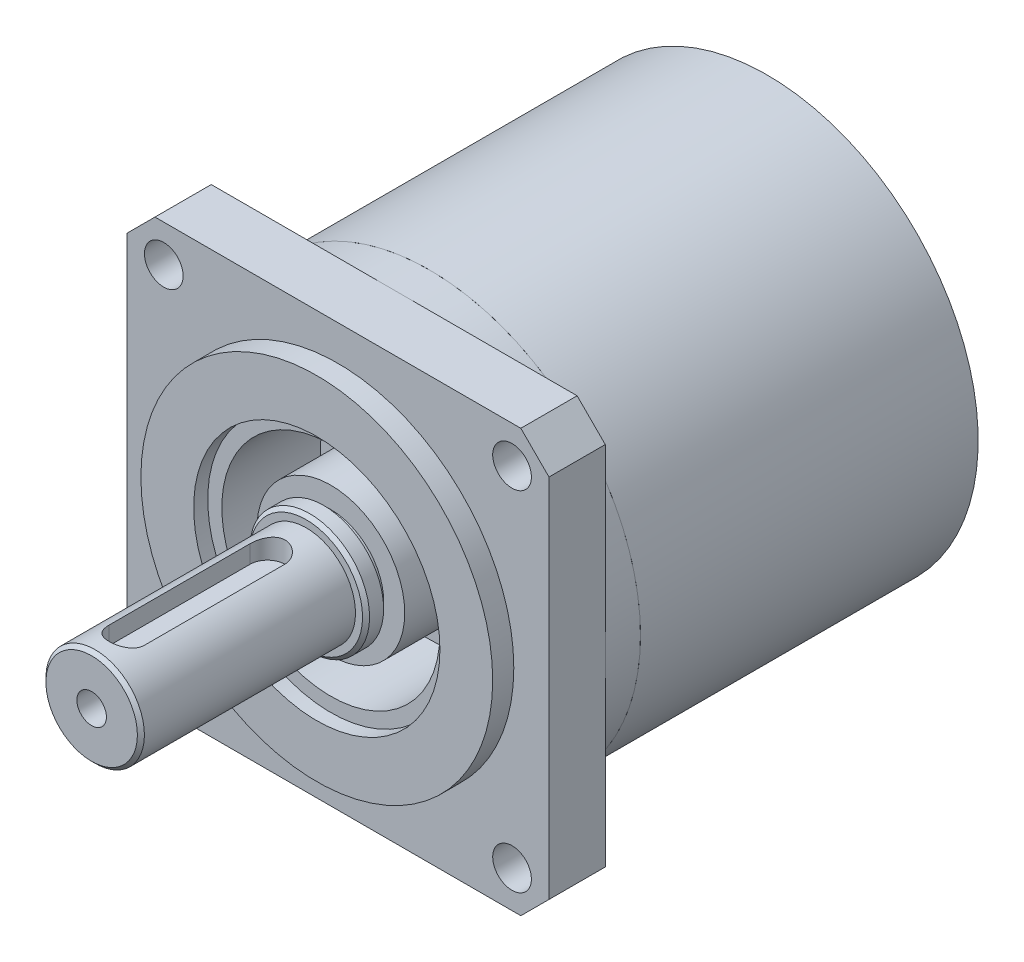
from build123d import *

# Parameters (mm, degrees)
SKETCH_1_R               = 30
EXTRUDE_1_DEPTH          = 13
SKETCH_2_R               = 30
EXTRUDE_2_DEPTH          = 48
SKETCH_3_R               = 25
SKETCH_3_R_2             = 17.5
EXTRUDE_3_DEPTH          = 3
CUT_EXTRUDE_START        = -13
SKETCH_4_R               = 17.5
CUT_EXTRUDE_1_DEPTH      = 13
SKETCH_6_R               = 17.5
SKETCH_6_R_2             = 15.5
EXTRUDE_4_DEPTH          = 14
SKETCH_7_R               = 10.5
EXTRUDE_5_DEPTH          = 14
SKETCH_8_R               = 8.5
EXTRUDE_6_DEPTH          = 3.5
SKETCH_9_R               = 7
EXTRUDE_7_DEPTH          = 30.5
CHAMFER_1_SIZE           = 0.5
SKETCH_10_R              = 15.5
SKETCH_10_R_2            = 7.5
CUT_EXTRUDE_7_DEPTH      = 1
CUT_EXTRUDE_8_DEPTH      = 10
EXTRUDE_8_DEPTH          = 8
SKETCH_19_R              = 2.75
CUT_EXTRUDE_9_DEPTH      = 8
PATTERN_CIRCULAR_1_COUNT = 4
CUT_EXTRUDE_START_2      = -8
SKETCH_21_R              = 15.5
SKETCH_21_R_2            = 10.5
CUT_EXTRUDE_11_DEPTH     = 8


with BuildPart() as part:
    # 草图1 → 凸台-拉伸1 (new body)
    with BuildSketch(Plane.XY):
        with Locations(Location((0, 0, 0), (0, 0, 180))):
            Circle(SKETCH_1_R)
    extrude(amount=EXTRUDE_1_DEPTH)

    # 草图3 → 凸台-拉伸3 (add)
    with BuildSketch(Plane.XY.offset(13)):
        Circle(SKETCH_3_R)
        Circle(SKETCH_3_R_2, mode=Mode.SUBTRACT)
    extrude(amount=EXTRUDE_3_DEPTH)

    # 草图4 → 切除-拉伸1 (cut)
    with BuildSketch(Plane.XY.offset(13).offset(CUT_EXTRUDE_START)):
        Circle(SKETCH_4_R)
    extrude(amount=CUT_EXTRUDE_1_DEPTH, mode=Mode.SUBTRACT)



with BuildPart() as body_2:
    # 草图2 → 凸台-拉伸2 (new body)
    with BuildSketch(Plane(origin=(0, 0, 0), x_dir=(-1, 0, 0), z_dir=(0, 0, -1))):
        Circle(SKETCH_2_R)
    extrude(amount=EXTRUDE_2_DEPTH)


with BuildPart() as body_3:
    # 草图6 → 凸台-拉伸4 (new body)
    with BuildSketch(Plane.XY):
        Circle(SKETCH_6_R)
        Circle(SKETCH_6_R_2, mode=Mode.SUBTRACT)
    extrude(amount=EXTRUDE_4_DEPTH)


with BuildPart() as body_4:
    # 草图7 → 凸台-拉伸5 (new body)
    with BuildSketch(Plane.XY):
        Circle(SKETCH_7_R)
    extrude(amount=EXTRUDE_5_DEPTH)

    # 草图8 → 凸台-拉伸6 (add)
    with BuildSketch(Plane.XY.offset(14)):
        Circle(SKETCH_8_R)
    extrude(amount=EXTRUDE_6_DEPTH)

    # 草图9 → 凸台-拉伸7 (add)
    with BuildSketch(Plane.XY.offset(17.5)):
        with Locations(Location((0, 0, 0), (0, 0, 180))):
            Circle(SKETCH_9_R)
    extrude(amount=EXTRUDE_7_DEPTH)

    # 倒角1
    chamfer_1_edges = [body_4.edges().sort_by_distance(p)[0] for p in [
        (7, 0, 48),
        (-8.5, 0, 17.5),
    ]]
    chamfer(chamfer_1_edges, length=CHAMFER_1_SIZE)

    # 草图10 → 切除-拉伸7 (cut)
    with BuildSketch(Plane.XY.offset(14)):
        Circle(SKETCH_10_R)
        Circle(SKETCH_10_R_2, mode=Mode.SUBTRACT)
    extrude(amount=CUT_EXTRUDE_7_DEPTH, mode=Mode.SUBTRACT)

    # 草图11 → 切除-拉伸8 (cut)
    with BuildSketch(Plane(origin=(0, 4, 0), x_dir=(1, 0, 0), z_dir=(0, 1, 0))):
        with BuildLine():
            Line((2.5, -23), (2.5, -43))
            ThreePointArc((2.5, -43), (0, -45.5), (-2.5, -43))
            Line((-2.5, -43), (-2.5, -23))
            ThreePointArc((-2.5, -23), (0, -20.5), (2.5, -23))
        make_face()
    extrude(amount=CUT_EXTRUDE_8_DEPTH, mode=Mode.SUBTRACT)

    # 草图12 → M5 螺纹孔1 (revolve, cut)
    with BuildSketch(Plane(origin=(0, 0, 48), x_dir=(0, -1, 0), z_dir=(1, 0, 0))):
        Polygon((0, 0), (0, 17.2618073), (2.1, 16), (2.1, 0), align=None)
    revolve(axis=Axis((0, 0, 54.35), (0, 0, -1)), mode=Mode.SUBTRACT)


with BuildPart() as part_1:
    add(part.part)

    add(body_3.part)  # 凸台-拉伸8 merges body 3

    add(body_4.part)  # 凸台-拉伸8 merges body 4
    # 草图18 → 凸台-拉伸8 (add)
    with BuildSketch(Plane.XY.offset(13)):
        Polygon((26, 30), (30, 26), (30, -26), (26, -30), (-26, -30), (-30, -26), (-30, 26), (-26, 30), align=None)
    extrude(amount=-EXTRUDE_8_DEPTH)

    # 草图19 → 切除-拉伸9 (cut)
    with BuildSketch(Plane.XY.offset(13)):
        with Locations((24.748737342, 24.748737342)):
            Circle(SKETCH_19_R)
    cut_extrude_9 = extrude(amount=-CUT_EXTRUDE_9_DEPTH, mode=Mode.SUBTRACT)

    # 阵列(圆周)1: 切除-拉伸9 ×4 about axis
    pattern_circular_1_axis = Axis((0, 0, 0), (0, 0, 1))
    for i in range(1, PATTERN_CIRCULAR_1_COUNT):
        add(cut_extrude_9.rotate(pattern_circular_1_axis, i * 360 / PATTERN_CIRCULAR_1_COUNT), mode=Mode.SUBTRACT)

    # 草图21 → 切除-拉伸11 (cut)
    with BuildSketch(Plane.XY.offset(13).offset(CUT_EXTRUDE_START_2)):
        Circle(SKETCH_21_R)
        Circle(SKETCH_21_R_2, mode=Mode.SUBTRACT)
    extrude(amount=CUT_EXTRUDE_11_DEPTH, mode=Mode.SUBTRACT)


with BuildPart() as cut_extrude_11_piece_1:
    # of the separate pieces the step leaves, piece 1, a body of its own (cut_extrude_11_pieces)
    add(part_1.part.solids().sort_by_distance((15.5, 0, 14))[0])


with BuildPart() as cut_extrude_11_piece_2:
    # of the separate pieces the step leaves, piece 2, a body of its own (cut_extrude_11_pieces)
    add(part_1.part.solids().sort_by_distance((10.5, 0, 14))[0])


solid = Compound([body_2.part, cut_extrude_11_piece_1.part, cut_extrude_11_piece_2.part])
